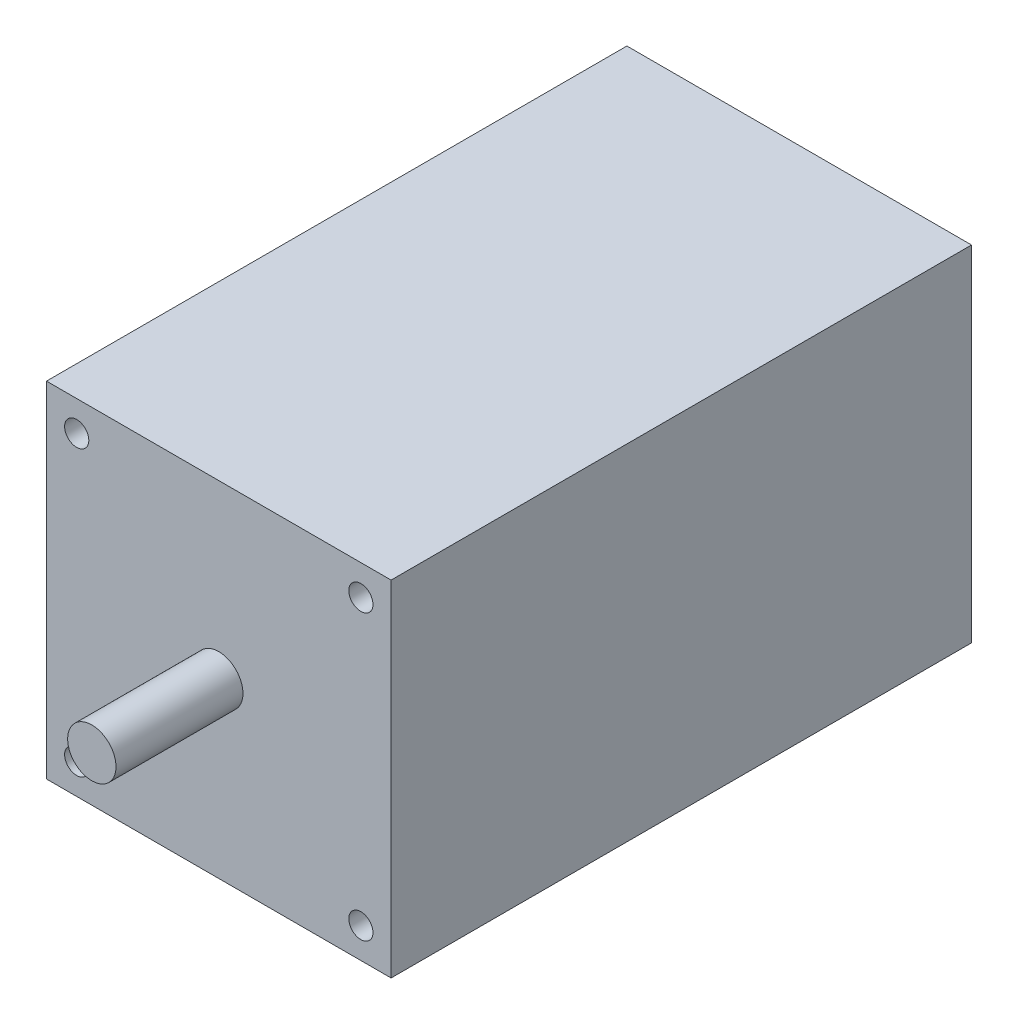
from build123d import *

# Parameters (mm, degrees)
SKETCH_1_W      = 57
SKETCH_1_H      = 57
SKETCH_1_R      = 2
EXTRUDE_1_DEPTH = 96
SKETCH_2_R      = 4
EXTRUDE_2_DEPTH = 21


with BuildPart() as part:
    # 草圖1 → 填料-伸長1 (new body)
    with BuildSketch(Plane.XY):
        Rectangle(SKETCH_1_W, SKETCH_1_H)
        with Locations((-23.5, 23.5)):
            Circle(SKETCH_1_R, mode=Mode.SUBTRACT)
        with Locations((23.5, 23.5)):
            Circle(SKETCH_1_R, mode=Mode.SUBTRACT)
        with Locations(Location((23.5, -23.5, 0), (0, 0, 180))):
            Circle(SKETCH_1_R, mode=Mode.SUBTRACT)
        with Locations(Location((-23.5, -23.5, 0), (0, 0, 180))):
            Circle(SKETCH_1_R, mode=Mode.SUBTRACT)
    extrude(amount=-EXTRUDE_1_DEPTH)

    # 草圖2 → 填料-伸長2 (add)
    with BuildSketch(Plane.XY):
        with Locations(Location((0, 0, 0), (0, 0, 180))):
            Circle(SKETCH_2_R)
    extrude(amount=EXTRUDE_2_DEPTH)


solid = part.part
